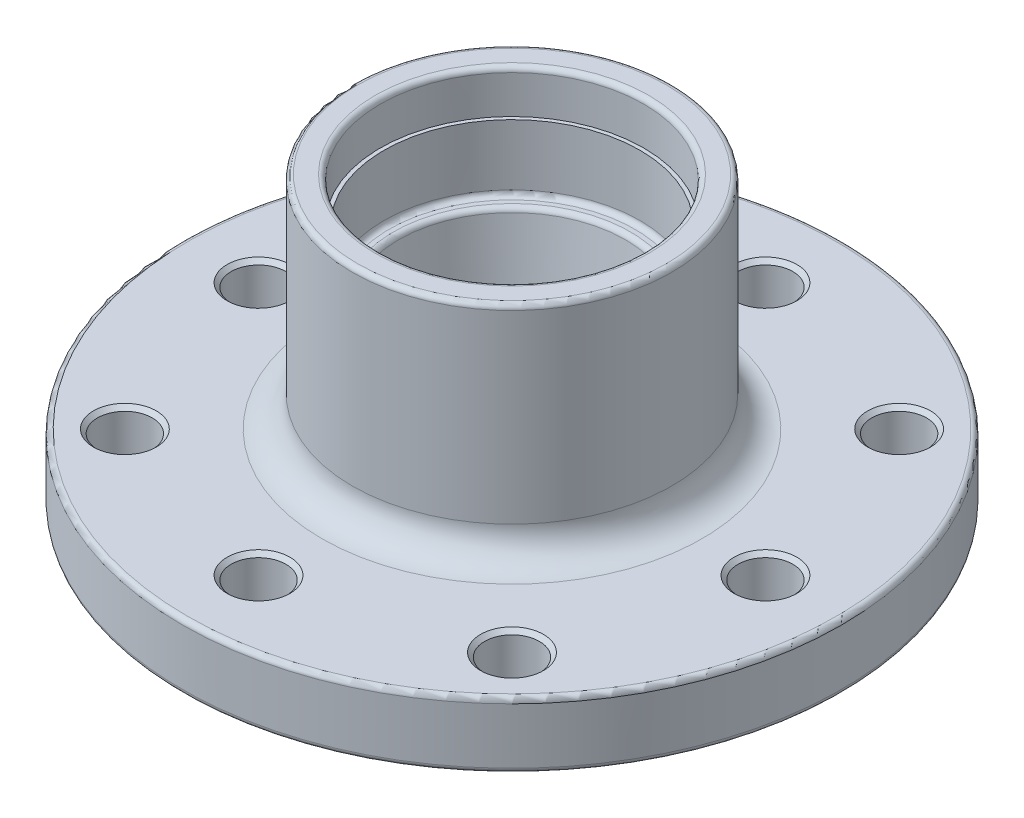
from build123d import *

# Parameters (mm, degrees)
FILETE1_R             = 6
FILETE2_R             = 1
FILETE3_R             = 1
FILETE4_R             = 1
ESBO_O2_R             = 5.4
CORTE_EXTRUS_O1_DEPTH = 108.899258683
ESBO_O3_R             = 5.4
CORTE_EXTRUS_O2_DEPTH = 108.899258683
CHANFRO1_SIZE         = 0.8


with BuildPart() as part:
    # Esboço1 → Revolução1 (revolve)
    with BuildSketch(Plane.XY, mode=Mode.PRIVATE) as revolu_o1_sk:
        Polygon((26, 58.554097453), (31.5, 58.554097453), (31.5, 15.054097453), (65, 15.054097453), (65, 2.054097453), (27.5, 2.054097453), (27.5, -17.445902547), (20, -17.445902547), (20, 1.554097453), (17.5, 1.554097453), (22.5, 37.054097453), (25.25, 37.054097453), (25.25, 50.054097453), (26, 50.054097453), align=None)
    revolve(revolu_o1_sk.sketch.rotate(Axis((0, -38.852436323, 0), (0, 1, 0)), 90), axis=Axis((0, -38.852436323, 0), (0, 1, 0)))

    # Filete1
    filete1_edges = [part.edges().sort_by_distance(p)[0] for p in [
        (0, 15.054097453, 31.5),
    ]]
    fillet(filete1_edges, radius=FILETE1_R)

    # Filete2
    filete2_edges = [part.edges().sort_by_distance(p)[0] for p in [
        (0, 2.054097453, 65),
        (0, 15.054097453, 65),
        (0, 58.554097453, 31.5),
        (0, 58.554097453, 26),
    ]]
    fillet(filete2_edges, radius=FILETE2_R)

    # Filete3
    filete3_edges = [part.edges().sort_by_distance(p)[0] for p in [
        (0, 37.054097453, 22.5),
        (0, 1.554097453, 20),
        (0, -17.445902547, 27.5),
        (0, 2.054097453, 27.5),
    ]]
    fillet(filete3_edges, radius=FILETE3_R)

    # Filete4
    filete4_edges = [part.edges().sort_by_distance(p)[0] for p in [
        (0, 37.054097453, 25.25),
    ]]
    fillet(filete4_edges, radius=FILETE4_R)

    # Esboço2 → Corte-extrusão1 (cut, through all)
    with BuildSketch(Plane.XZ.offset(-2.054097453)):
        with Locations(Location((0, 50, 0), (0, 0, 270))):
            Circle(ESBO_O2_R)
        with Locations(Location((50, 0, 0), (0, 0, 270))):
            Circle(ESBO_O2_R)
        with Locations(Location((0, -50, 0), (0, 0, 270))):
            Circle(ESBO_O2_R)
        with Locations(Location((-50, 0, 0), (0, 0, 270))):
            Circle(ESBO_O2_R)
    extrude(amount=-CORTE_EXTRUS_O1_DEPTH, mode=Mode.SUBTRACT)

    # Esboço3 → Corte-extrusão2 (cut, through all)
    with BuildSketch(Plane.XZ.offset(-2.054097453)):
        with Locations(Location((38.183766184, 38.183766184, 0), (0, 0, 270))):
            Circle(ESBO_O3_R)
        with Locations(Location((38.183766184, -38.183766184, 0), (0, 0, 270))):
            Circle(ESBO_O3_R)
        with Locations(Location((-38.183766184, -38.183766184, 0), (0, 0, 270))):
            Circle(ESBO_O3_R)
        with Locations(Location((-38.183766184, 38.183766184, 0), (0, 0, 270))):
            Circle(ESBO_O3_R)
    extrude(amount=-CORTE_EXTRUS_O2_DEPTH, mode=Mode.SUBTRACT)

    # Chanfro1
    chanfro1_edges = [part.edges().sort_by_distance(p)[0] for p in [
        (0, 15.054097453, 55.4),
        (0, 2.054097453, 55.4),
        (50, 15.054097453, 5.4),
        (50, 2.054097453, 5.4),
        (0, 15.054097453, -44.6),
        (0, 2.054097453, -44.6),
        (-50, 15.054097453, 5.4),
        (-50, 2.054097453, 5.4),
        (38.183766184, 15.054097453, 43.583766184),
        (38.183766184, 2.054097453, 43.583766184),
        (38.183766184, 15.054097453, -32.783766184),
        (38.183766184, 2.054097453, -32.783766184),
        (-38.183766184, 15.054097453, -32.783766184),
        (-38.183766184, 2.054097453, -32.783766184),
        (-38.183766184, 15.054097453, 43.583766184),
        (-38.183766184, 2.054097453, 43.583766184),
    ]]
    chamfer(chanfro1_edges, length=CHANFRO1_SIZE)


solid = part.part
